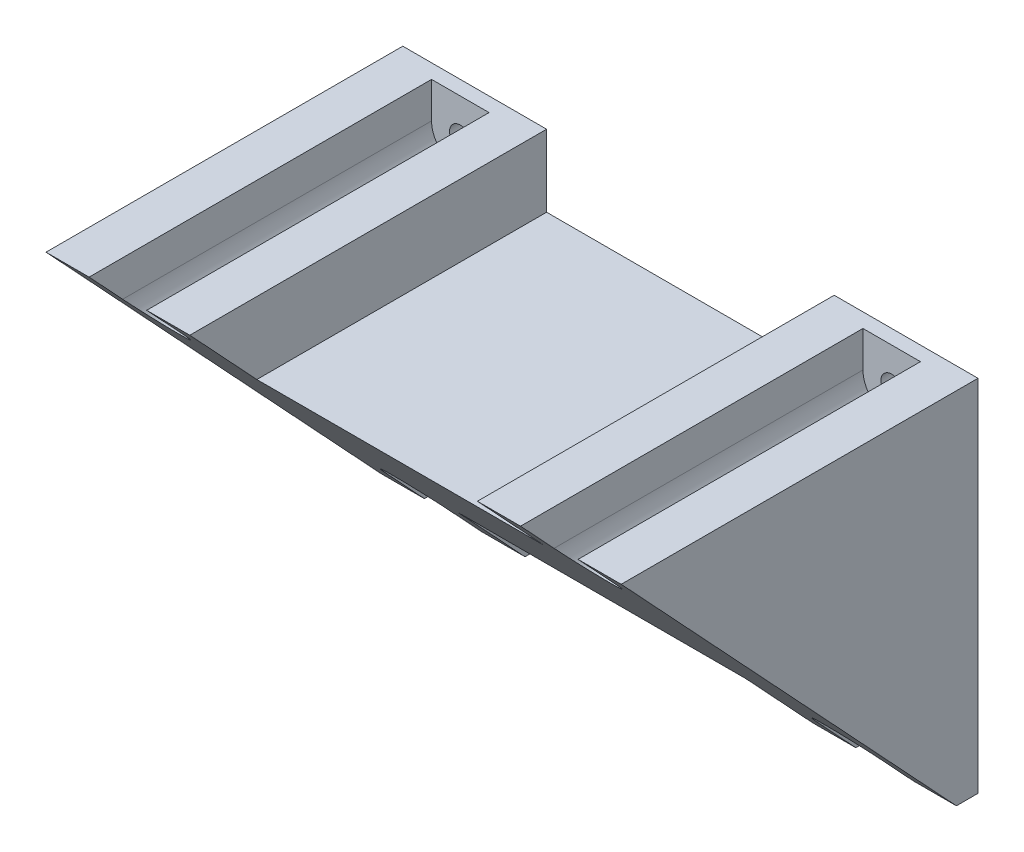
from build123d import *

# Parameters (mm, degrees)
EXTRUDE_2_DEPTH     = 2
SKETCH_3_R          = 1.5
CUT_EXTRUDE_1_DEPTH = 95.361008897
EXTRUDE_3_DEPTH     = 1
DRAFT_4_ANGLE       = 43


with BuildPart() as part:
    # 草图1 → 凸台-拉伸2 (new body)
    with BuildSketch(Plane.XY):
        Polygon((0, 0), (0, 50), (20, 50), (20, 40), (60, 40), (60, 50), (80, 50), (80, 0), (60, 0), (60, 10), (20, 10), (20, 0), align=None)
    extrude(amount=EXTRUDE_2_DEPTH)

    # 草图3 → 切除-拉伸1 (cut, through all)
    with BuildSketch(Plane.XY.offset(2)):
        with Locations((10, 45)):
            Circle(SKETCH_3_R)
        with Locations((10, 5)):
            Circle(SKETCH_3_R)
        with Locations((70, 45)):
            Circle(SKETCH_3_R)
        with Locations((70, 5)):
            Circle(SKETCH_3_R)
    extrude(amount=-CUT_EXTRUDE_1_DEPTH, mode=Mode.SUBTRACT)

    # 草图5 → 凸台-拉伸3 (add)
    with BuildSketch(Plane.XY.offset(2)):
        with BuildLine():
            Line((0, 50), (6, 50))
            Line((6, 50), (6, 45))
            ThreePointArc((6, 45), (10, 41), (14, 45))
            Line((14, 45), (14, 50))
            Line((14, 50), (20, 50))
            Line((20, 50), (20, 40))
            Line((20, 40), (60, 40))
            Line((60, 40), (60, 50))
            Line((60, 50), (66, 50))
            Line((66, 50), (66, 45))
            ThreePointArc((66, 45), (70, 41), (74, 45))
            Line((74, 45), (74, 50))
            Line((74, 50), (80, 50))
            Line((80, 50), (80, 0))
            Line((80, 0), (74, 0))
            Line((74, 0), (74, 5))
            ThreePointArc((74, 5), (70, 9), (66, 5))
            Line((66, 5), (66, 0))
            Line((66, 0), (60, 0))
            Line((60, 0), (60, 10))
            Line((60, 10), (20, 10))
            Line((20, 10), (20, 0))
            Line((20, 0), (14, 0))
            Line((14, 0), (14, 5))
            ThreePointArc((14, 5), (10, 9), (6, 5))
            Line((6, 5), (6, 0))
            Line((6, 0), (0, 0))
            Line((0, 0), (0, 50))
        make_face()
    extrude(amount=EXTRUDE_3_DEPTH)

    # 拔模4
    draft_4_faces = [part.faces().sort_by_distance(p)[0] for p in [
        (40, 25, 3),
    ]]
    draft(draft_4_faces, Plane(origin=(20, 0, 2), x_dir=(-1, 0, 0), z_dir=(0, -1, 0)), DRAFT_4_ANGLE)


solid = part.part
